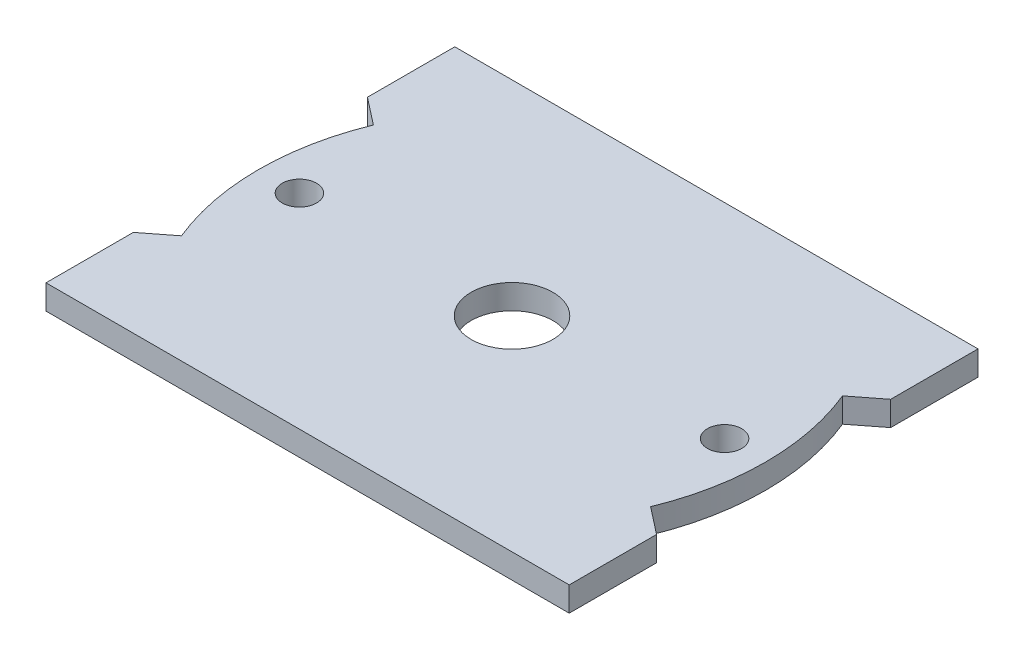
from build123d import *

# Parameters (mm, degrees)
SKETCH1_R           = 2.1
BOSS_EXTRUDE2_DEPTH = 3
SKETCH1_14_R        = 5
CUT_EXTRUDE2_DEPTH  = 10


with BuildPart() as part:
    # Sketch1 → Boss-Extrude2 (new body)
    with BuildSketch(Plane(origin=(0, 0, 0), x_dir=(1, 0, 0), z_dir=(0, 1, 0))):
        with BuildLine():
            Line((32, -25), (32, -14.320549047))
            Line((32, -14.320549047), (28.692414075, -11.736497543))
            ThreePointArc((28.692414075, -11.736497543), (31, 0), (28.692414075, 11.736497543))
            Line((28.692414075, 11.736497543), (32, 14.320549047))
            Line((32, 14.320549047), (32, 25))
            Line((32, 25), (-32, 25))
            Line((-32, 25), (-32, 14.320549047))
            Line((-32, 14.320549047), (-28.692414075, 11.736497543))
            ThreePointArc((-28.692414075, 11.736497543), (-31, 0), (-28.692414075, -11.736497543))
            Line((-28.692414075, -11.736497543), (-32, -14.320549047))
            Line((-32, -14.320549047), (-32, -25))
            Line((-32, -25), (32, -25))
        make_face()
        with Locations((26, 0)):
            Circle(SKETCH1_R, mode=Mode.SUBTRACT)
        with Locations((-26, 0)):
            Circle(SKETCH1_R, mode=Mode.SUBTRACT)
    extrude(amount=BOSS_EXTRUDE2_DEPTH)

    # Sketch1<14> → Cut-Extrude2 (cut)
    with BuildSketch(Plane(origin=(0, 0, 0), x_dir=(1, 0, 0), z_dir=(0, 1, 0))):
        Circle(SKETCH1_14_R)
    extrude(amount=CUT_EXTRUDE2_DEPTH, mode=Mode.SUBTRACT)


solid = part.part
